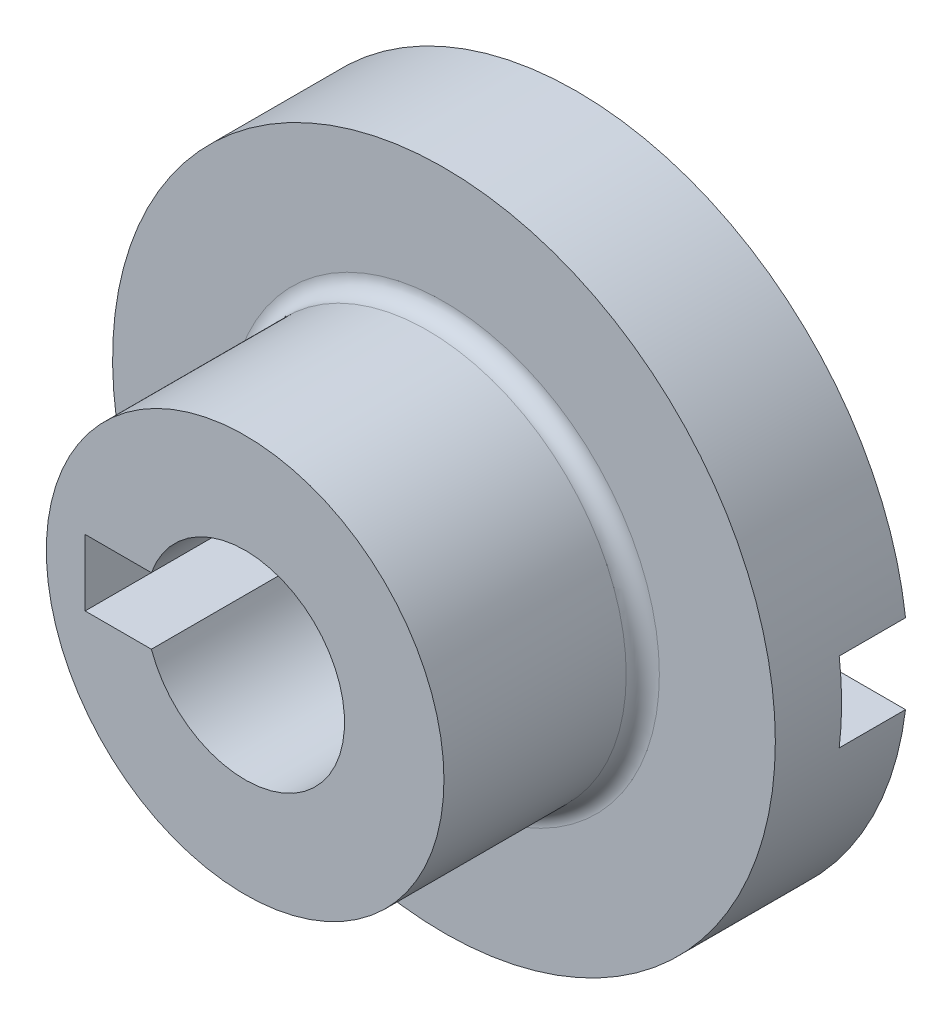
from build123d import *

# Parameters (mm, degrees)
SKETCH2_R           = 50
BOSS_EXTRUDE1_DEPTH = 20
SKETCH3_R           = 30
BOSS_EXTRUDE2_DEPTH = 30
FILLET1_R           = 2.5
SKETCH4_W           = 110
SKETCH4_H           = 12
CUT_EXTRUDE1_DEPTH  = 10
CUT_EXTRUDE2_REACH  = 88.603


with BuildPart() as part:
    # Sketch2 → Boss-Extrude1 (new body)
    with BuildSketch(Plane.XY):
        Circle(SKETCH2_R)
    extrude(amount=BOSS_EXTRUDE1_DEPTH)

    # Sketch3 → Boss-Extrude2 (add)
    with BuildSketch(Plane.XY.offset(20)):
        Circle(SKETCH3_R)
    extrude(amount=BOSS_EXTRUDE2_DEPTH)

    # Fillet1
    fillet1_edges = [part.edges().sort_by_distance(p)[0] for p in [
        (-30, 0, 20),
    ]]
    fillet(fillet1_edges, radius=FILLET1_R)

    # Sketch4 → Cut-Extrude1 (cut)
    with BuildSketch(Plane(origin=(0, 0, 0), x_dir=(-1, 0, 0), z_dir=(0, 0, -1))):
        Rectangle(SKETCH4_W, SKETCH4_H)
    extrude(amount=-CUT_EXTRUDE1_DEPTH, mode=Mode.SUBTRACT)

    # Cut-Extrude2: up to this face of the body (flat: up to its plane)
    cut_extrude2_end = Plane(part.part.faces().sort_by_distance((0, 24.497956202, 0))[0])
    # Sketch5 → Cut-Extrude2 (cut, up to the picked face)
    with BuildSketch(Plane.XY.offset(50), mode=Mode.PRIVATE) as cut_extrude2_sk1:
        with BuildLine():
            Line((-14.142135624, 5), (-24.142135624, 5))
            Line((-24.142135624, 5), (-24.142135624, -5))
            Line((-24.142135624, -5), (-14.142135624, -5))
            ThreePointArc((-14.142135624, -5), (15, 0), (-14.142135624, 5))
        make_face()
    cut_extrude2_tool1 = split(extrude(cut_extrude2_sk1.sketch, amount=-CUT_EXTRUDE2_REACH, mode=Mode.PRIVATE), bisect_by=cut_extrude2_end, keep=Keep.BOTH, mode=Mode.PRIVATE)
    add(cut_extrude2_tool1.solids().sort_by(Axis((-2.285441, 0, 50), (0, 0, -1)))[0], mode=Mode.SUBTRACT)


solid = part.part
